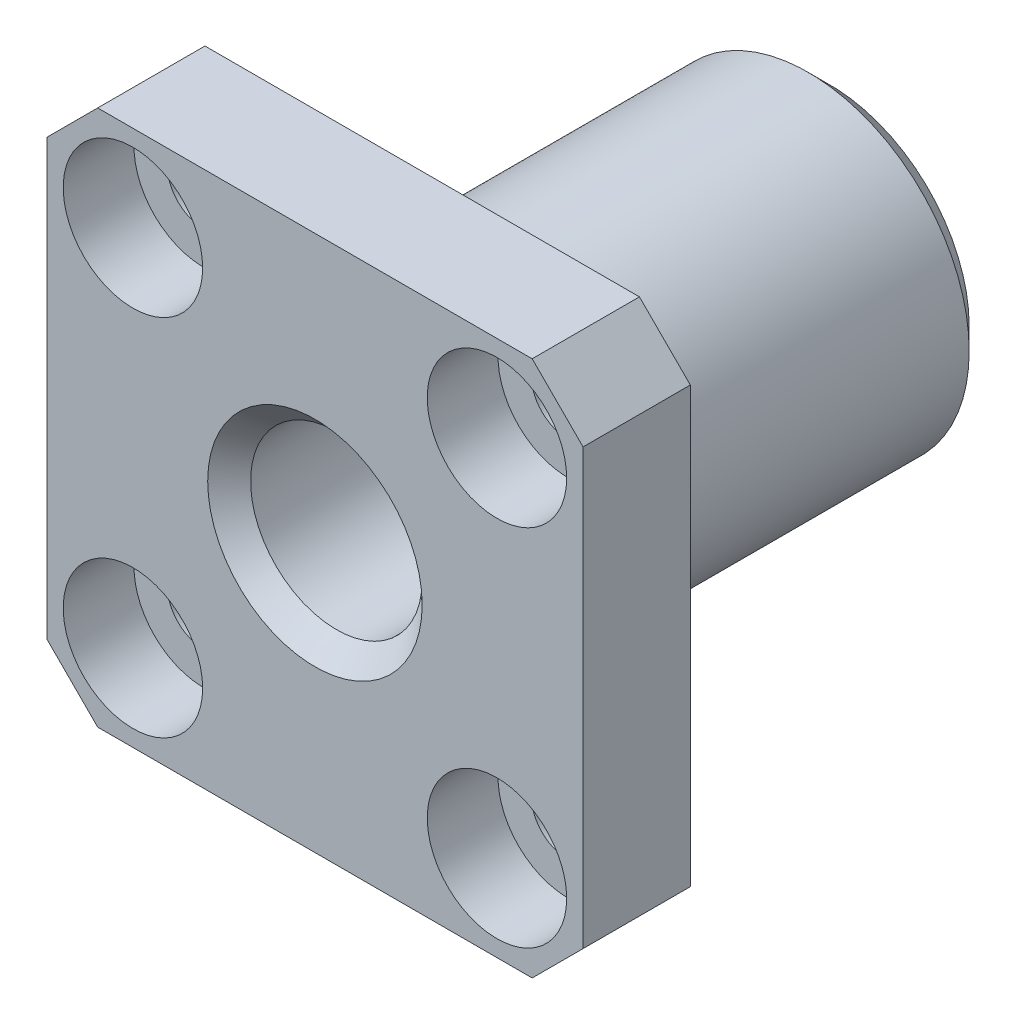
from build123d import *

# Parameters (mm, degrees)
SKETCH1_R                                           = 7.5
BOSS_EXTRUDE1_DEPTH                                 = 24
SKETCH2_W                                           = 25
SKETCH2_H                                           = 25
BOSS_EXTRUDE2_DEPTH                                 = 5
CUT_EXTRUDE1_DEPTH                                  = 30.807717122
CBORE_FOR_M3_HEX_SOCKET_HEAD_CAP_SCREW1_D           = 3.4
CBORE_FOR_M3_HEX_SOCKET_HEAD_CAP_SCREW1_DEPTH       = 22
CBORE_FOR_M3_HEX_SOCKET_HEAD_CAP_SCREW1_CBORE_D     = 6.5
CBORE_FOR_M3_HEX_SOCKET_HEAD_CAP_SCREW1_CBORE_DEPTH = 3.3
CBORE_FOR_M3_HEX_SOCKET_HEAD_CAP_SCREW1_TIP         = 1.021463052
SKETCH8_R                                           = 4
CUT_EXTRUDE2_DEPTH                                  = 30.807717122
CHAMFER1_SIZE                                       = 1


with BuildPart() as part:
    # Sketch1 → Boss-Extrude1 (new body)
    with BuildSketch(Plane.XY):
        Circle(SKETCH1_R)
    extrude(amount=BOSS_EXTRUDE1_DEPTH)

    # Sketch2 → Boss-Extrude2 (add)
    with BuildSketch(Plane.XY.offset(24)):
        Rectangle(SKETCH2_W, SKETCH2_H)
    extrude(amount=-BOSS_EXTRUDE2_DEPTH)

    # Sketch4 → Cut-Extrude1 (cut, through all)
    with BuildSketch(Plane.XY.offset(24)):
        Polygon((-12.5, 12.5), (-12.5, 10.127416998), (-10.127416998, 12.5), align=None)
        Polygon((10.127416998, 12.5), (12.5, 12.5), (12.5, 10.127416998), align=None)
        Polygon((12.5, -12.5), (12.5, -10.127416998), (10.127416998, -12.5), align=None)
        Polygon((-10.127416998, -12.5), (-12.5, -12.5), (-12.5, -10.127416998), align=None)
    extrude(amount=-CUT_EXTRUDE1_DEPTH, mode=Mode.SUBTRACT)

    # CBORE for M3 Hex Socket Head Cap Screw1
    with Locations(Plane.XY.offset(24)):
        with Locations((-8.485281374, 8.485281374), (8.485281374, 8.485281374), (8.485281374, -8.485281374), (-8.485281374, -8.485281374)):
            CounterBoreHole(CBORE_FOR_M3_HEX_SOCKET_HEAD_CAP_SCREW1_D / 2, CBORE_FOR_M3_HEX_SOCKET_HEAD_CAP_SCREW1_CBORE_D / 2, CBORE_FOR_M3_HEX_SOCKET_HEAD_CAP_SCREW1_CBORE_DEPTH, depth=CBORE_FOR_M3_HEX_SOCKET_HEAD_CAP_SCREW1_DEPTH)
            with Locations((0, 0, -(CBORE_FOR_M3_HEX_SOCKET_HEAD_CAP_SCREW1_DEPTH + CBORE_FOR_M3_HEX_SOCKET_HEAD_CAP_SCREW1_TIP / 2))):  # 118° drill point
                Cone(0, CBORE_FOR_M3_HEX_SOCKET_HEAD_CAP_SCREW1_D / 2, CBORE_FOR_M3_HEX_SOCKET_HEAD_CAP_SCREW1_TIP, mode=Mode.SUBTRACT)

    # Sketch8 → Cut-Extrude2 (cut, through all)
    with BuildSketch(Plane.XY.offset(24)):
        Circle(SKETCH8_R)
    extrude(amount=-CUT_EXTRUDE2_DEPTH, mode=Mode.SUBTRACT)

    # Chamfer1
    chamfer1_edges = [part.edges().sort_by_distance(p)[0] for p in [
        (-4, 0, 24),
        (-7.5, 0, 0),
    ]]
    chamfer(chamfer1_edges, length=CHAMFER1_SIZE)


solid = part.part
